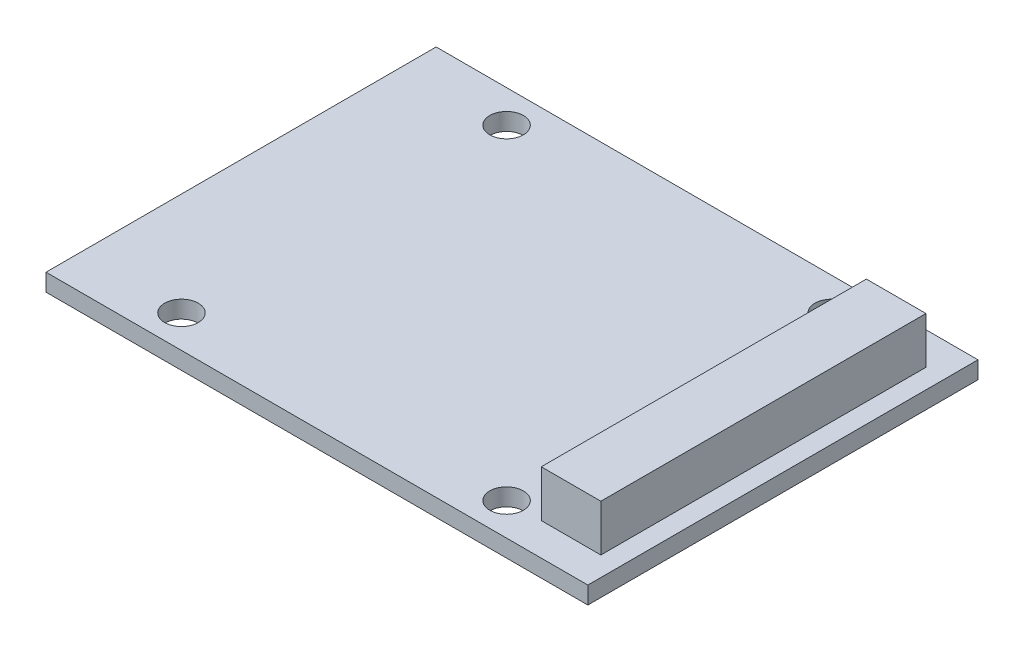
from build123d import *

# Parameters (mm, degrees)
SKETCH1_W           = 50
SKETCH1_H           = 36
SKETCH1_R           = 1.55
BOSS_EXTRUDE1_DEPTH = 1.6
SKETCH2_W           = 5.5
SKETCH2_H           = 30
BOSS_EXTRUDE2_DEPTH = 4.3


with BuildPart() as part:
    # Sketch1 → Boss-Extrude1 (new body)
    with BuildSketch(Plane(origin=(0, 0, 0), x_dir=(1, 0, 0), z_dir=(0, 1, 0))):
        Rectangle(SKETCH1_W, SKETCH1_H)
        with Locations(Location((-15.5, 15, 0), (0, 0, 270))):
            Circle(SKETCH1_R, mode=Mode.SUBTRACT)
        with Locations(Location((-15.5, -15, 0), (0, 0, 90))):
            Circle(SKETCH1_R, mode=Mode.SUBTRACT)
        with Locations(Location((14.5, 15, 0), (0, 0, 270))):
            Circle(SKETCH1_R, mode=Mode.SUBTRACT)
        with Locations(Location((14.5, -15, 0), (0, 0, 90))):
            Circle(SKETCH1_R, mode=Mode.SUBTRACT)
    extrude(amount=BOSS_EXTRUDE1_DEPTH)

    # Sketch2 → Boss-Extrude2 (add)
    with BuildSketch(Plane(origin=(0, 1.6, 0), x_dir=(1, 0, 0), z_dir=(0, 1, 0))):
        with Locations((20.45, 0)):
            Rectangle(SKETCH2_W, SKETCH2_H)
    extrude(amount=BOSS_EXTRUDE2_DEPTH)


solid = part.part
